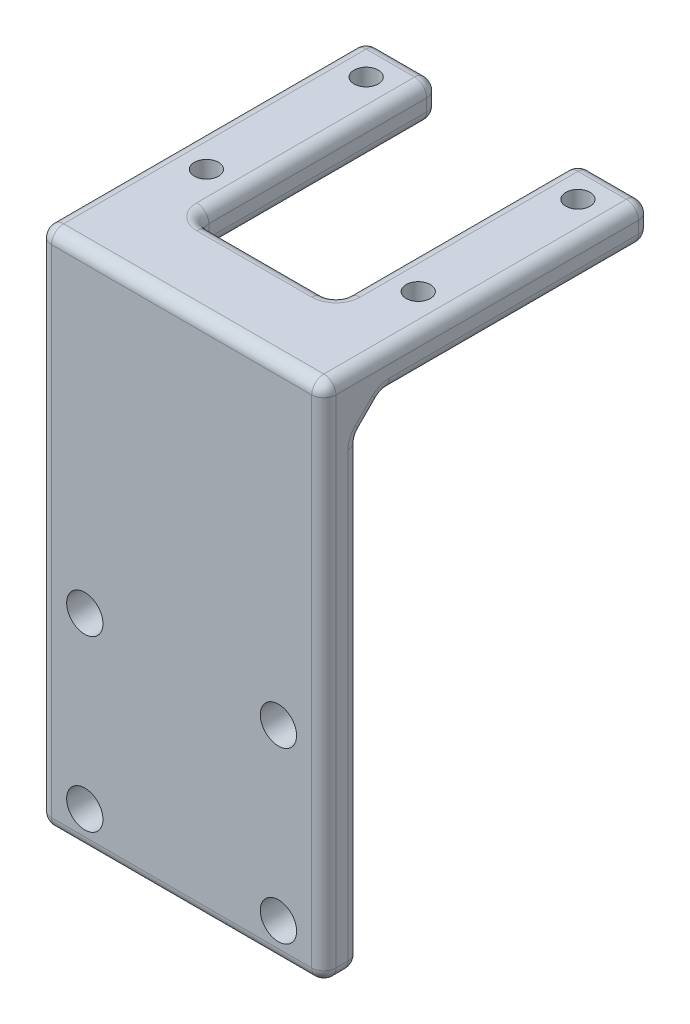
from build123d import *

# Parameters (mm, degrees)
SKETCH_1_W      = 23.5
SKETCH_1_H      = 40
SKETCH_1_R      = 1.5
EXTRUDE_1_DEPTH = 3
SKETCH_2_R      = 1
SKETCH_2_W      = 23.5
SKETCH_2_H      = 3
EXTRUDE_2_DEPTH = 3
CHAMFER_1_SIZE  = 2
FILLET_1_R      = 1


with BuildPart() as part:
    # 草图1 → 凸台-拉伸1 (new body)
    with BuildSketch(Plane.XY):
        Rectangle(SKETCH_1_W, SKETCH_1_H)
        with Locations((-8, -3)):
            Circle(SKETCH_1_R, mode=Mode.SUBTRACT)
        with Locations((8, -3)):
            Circle(SKETCH_1_R, mode=Mode.SUBTRACT)
        with Locations((8, -17)):
            Circle(SKETCH_1_R, mode=Mode.SUBTRACT)
        with Locations((-8, -17)):
            Circle(SKETCH_1_R, mode=Mode.SUBTRACT)
    extrude(amount=EXTRUDE_1_DEPTH)

    # 草图2 → 凸台-拉伸2 (add)
    # profile 1 of 2: a face of its own
    with BuildSketch(Plane(origin=(0, 20, 0), x_dir=(1, 0, 0), z_dir=(0, 1, 0))):
        Polygon((-5.75, 24), (-11.75, 24), (-11.75, 0), (11.75, 0), (11.75, 24), (5.75, 24), (5.75, 4), (-5.75, 4), align=None)
        with Locations(Location((-8.75, 7.8, 0), (0, 0, 270))):
            Circle(SKETCH_2_R, mode=Mode.SUBTRACT)
        with Locations(Location((8.75, 7.8, 0), (0, 0, 270))):
            Circle(SKETCH_2_R, mode=Mode.SUBTRACT)
        with Locations(Location((-8.75, 21, 0), (0, 0, 270))):
            Circle(SKETCH_2_R, mode=Mode.SUBTRACT)
        with Locations(Location((8.75, 21, 0), (0, 0, 270))):
            Circle(SKETCH_2_R, mode=Mode.SUBTRACT)
    # profile 2 of 2: a face of its own
    with BuildSketch(Plane(origin=(0, 20, 0), x_dir=(1, 0, 0), z_dir=(0, 1, 0))):
        with Locations((0, -1.5)):
            Rectangle(SKETCH_2_W, SKETCH_2_H)
    extrude(amount=EXTRUDE_2_DEPTH)

    # 倒角1
    chamfer_1_edges = [part.edges().sort_by_distance(p)[0] for p in [
        (0, 20, 0),
    ]]
    chamfer(chamfer_1_edges, length=CHAMFER_1_SIZE)

    # 圆角1
    fillet_1_edges = [part.edges().sort_by_distance(p)[0] for p in [
        (-11.75, 1.5, 3),
        (0, -20, 3),
        (11.75, 20, -13),
        (-8.75, 20, -24),
        (-5.75, 20, -14),
        (0, 20, -4),
        (8.75, 20, -24),
        (8.75, 23, -24),
        (11.75, 21.5, -24),
        (5.75, 20, -14),
        (5.75, 21.5, -24),
        (0, 23, -4),
        (5.75, 21.5, -4),
        (-5.75, 23, -14),
        (-5.75, 21.5, -4),
        (-8.75, 23, -24),
        (-5.75, 21.5, -24),
        (-11.75, 20, -13),
        (-11.75, 21.5, -24),
        (11.75, 23, -10.5),
        (5.75, 23, -14),
        (-11.75, 23, -10.5),
        (0, 23, 3),
        (11.75, 1.5, 3),
        (0, -20, 0),
        (11.75, -1, 0),
        (0, 20, -2),
        (-11.75, -1, 0),
        (0, 18, 0),
        (-11.75, 19, -1),
        (11.75, 19, -1),
        (11.75, -20, 1.5),
        (-11.75, -20, 1.5),
    ]]
    fillet(fillet_1_edges, radius=FILLET_1_R)


solid = part.part
